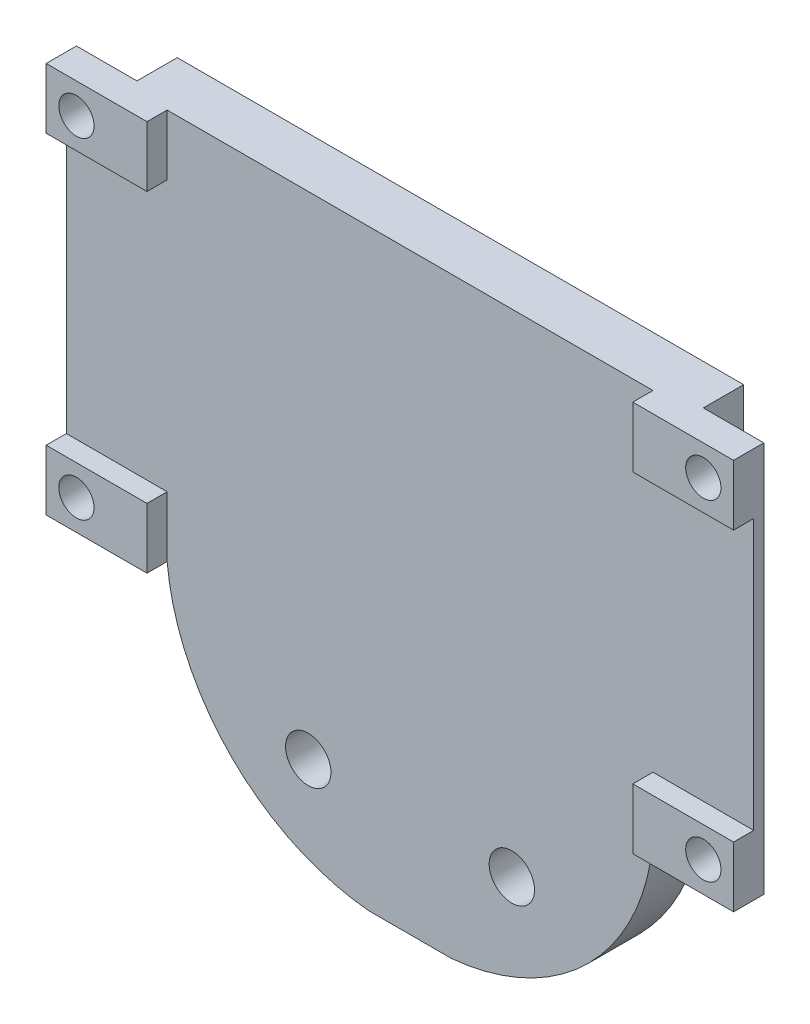
from build123d import *

# Parameters (mm, degrees)
ESQUISSE1_W                  = 68.2
ESQUISSE1_H                  = 38.8
BOSS_EXTRU_1_DEPTH           = 1
ESQUISSE3_W                  = 6
ESQUISSE3_H                  = 6
BOSS_EXTRU_2_DEPTH           = 2
ESQUISSE2_W                  = 6
ESQUISSE2_H                  = 6
BOSS_EXTRU_3_DEPTH           = 2
ENL_V_MAT_EXTRU_1_DEPTH      = 79.489999363
ENL_V_MAT_EXTRU_1_DEPTH_BACK = 79.489999363
ESQUISSE5_R                  = 1.75
ESQUISSE6_W                  = 10
ESQUISSE6_H                  = 6
ESQUISSE6_R                  = 1.75
ESQUISSE6_R_2                = 1.8692189
BOSS_EXTRU_4_DEPTH           = 3
ESQUISSE7_W                  = 56.2
ESQUISSE7_H                  = 38.8
BOSS_EXTRU_5_DEPTH           = 4
ESQUISSE8_W                  = 48.2
ESQUISSE8_H                  = 5
BOSS_EXTRU_6_DEPTH           = 20
ESQUISSE9_R                  = 2.25
ENL_V_MAT_EXTRU_2_DEPTH      = 20


with BuildPart() as part:
    # Esquisse1 → Boss.-Extru.1 (new body)
    with BuildSketch(Plane.XY):
        with Locations((34.1, 19.4)):
            Rectangle(ESQUISSE1_W, ESQUISSE1_H)
    extrude(amount=BOSS_EXTRU_1_DEPTH)

    # Esquisse3 → Boss.-Extru.2 (add)
    with BuildSketch(Plane.XY.offset(1)):
        with Locations((65.2, 35.8)):
            Rectangle(ESQUISSE3_W, ESQUISSE3_H)
        with Locations((65.2, 3)):
            Rectangle(ESQUISSE3_W, ESQUISSE3_H)
        with Locations((3, 3)):
            Rectangle(ESQUISSE3_W, ESQUISSE3_H)
    extrude(amount=BOSS_EXTRU_2_DEPTH)

    # Esquisse2 → Boss.-Extru.3 (add)
    with BuildSketch(Plane.XY.offset(1)):
        with Locations((3, 35.8)):
            Rectangle(ESQUISSE2_W, ESQUISSE2_H)
    extrude(amount=BOSS_EXTRU_3_DEPTH)

    # Esquisse5 → Enlèv. mat.-Extru.1 (cut, two sides: drawn at the far end of the back side and taken through both)
    with BuildSketch(Plane.XY.offset(1).offset(-ENL_V_MAT_EXTRU_1_DEPTH_BACK)):
        with Locations((3, 35.8)):
            Circle(ESQUISSE5_R)
        with Locations((3, 3)):
            Circle(ESQUISSE5_R)
        with Locations((65.2, 3)):
            Circle(ESQUISSE5_R)
        with Locations((65.2, 35.8)):
            Circle(ESQUISSE5_R)
    extrude(amount=ENL_V_MAT_EXTRU_1_DEPTH + ENL_V_MAT_EXTRU_1_DEPTH_BACK, mode=Mode.SUBTRACT)

    # Esquisse6 → Boss.-Extru.4 (add)
    # profile 1 of 4: a face of its own
    with BuildSketch(Plane(origin=(0, 0, 0), x_dir=(-1, 0, 0), z_dir=(0, 0, -1))):
        with Locations((-63.2, 3)):
            Rectangle(ESQUISSE6_W, ESQUISSE6_H)
        with Locations(Location((-65.2, 3, 0), (0, 0, 180))):
            Circle(ESQUISSE6_R, mode=Mode.SUBTRACT)
    # profile 2 of 4: a face of its own
    with BuildSketch(Plane(origin=(0, 0, 0), x_dir=(-1, 0, 0), z_dir=(0, 0, -1))):
        with Locations((-63.2, 35.8)):
            Rectangle(ESQUISSE6_W, ESQUISSE6_H)
        with Locations((-65.2, 35.8)):
            Circle(ESQUISSE6_R_2, mode=Mode.SUBTRACT)
    # profile 3 of 4: a face of its own
    with BuildSketch(Plane(origin=(0, 0, 0), x_dir=(-1, 0, 0), z_dir=(0, 0, -1))):
        with Locations((-5, 3)):
            Rectangle(ESQUISSE6_W, ESQUISSE6_H)
        with Locations(Location((-3, 3, 0), (0, 0, 180))):
            Circle(ESQUISSE6_R, mode=Mode.SUBTRACT)
    # profile 4 of 4: a face of its own
    with BuildSketch(Plane(origin=(0, 0, 0), x_dir=(-1, 0, 0), z_dir=(0, 0, -1))):
        with Locations((-5, 35.8)):
            Rectangle(ESQUISSE6_W, ESQUISSE6_H)
        with Locations(Location((-3, 35.8, 0), (0, 0, 180))):
            Circle(ESQUISSE6_R, mode=Mode.SUBTRACT)
    extrude(amount=-BOSS_EXTRU_4_DEPTH)

    # Esquisse7 → Boss.-Extru.5 (add)
    with BuildSketch(Plane(origin=(0, 0, 0), x_dir=(-1, 0, 0), z_dir=(0, 0, -1))):
        with Locations((-34.1, 19.4)):
            Rectangle(ESQUISSE7_W, ESQUISSE7_H)
    extrude(amount=BOSS_EXTRU_5_DEPTH)

    # Esquisse8 → Boss.-Extru.6 (add)
    with BuildSketch(Plane.XZ):
        with Locations((34.1, -1.5)):
            Rectangle(ESQUISSE8_W, ESQUISSE8_H)
    extrude(amount=BOSS_EXTRU_6_DEPTH)

    # Esquisse9 → Enlèv. mat.-Extru.2 (cut)
    with BuildSketch(Plane.XY.offset(1)):
        with BuildLine():
            Line((10, 0), (10, -20))
            Line((10, -20), (30, -20))
            ThreePointArc((30, -20), (16.391056868, -13.608943132), (10, 0))
        make_face()
        with Locations((24, -10)):
            Circle(ESQUISSE9_R)
        with Locations((44.2, -10)):
            Circle(ESQUISSE9_R)
        with BuildLine():
            Line((58.2, -20), (58.2, 0))
            ThreePointArc((58.2, 0), (51.808943132, -13.608943132), (38.2, -20))
            Line((38.2, -20), (58.2, -20))
        make_face()
    extrude(amount=-ENL_V_MAT_EXTRU_2_DEPTH, mode=Mode.SUBTRACT)


solid = part.part
